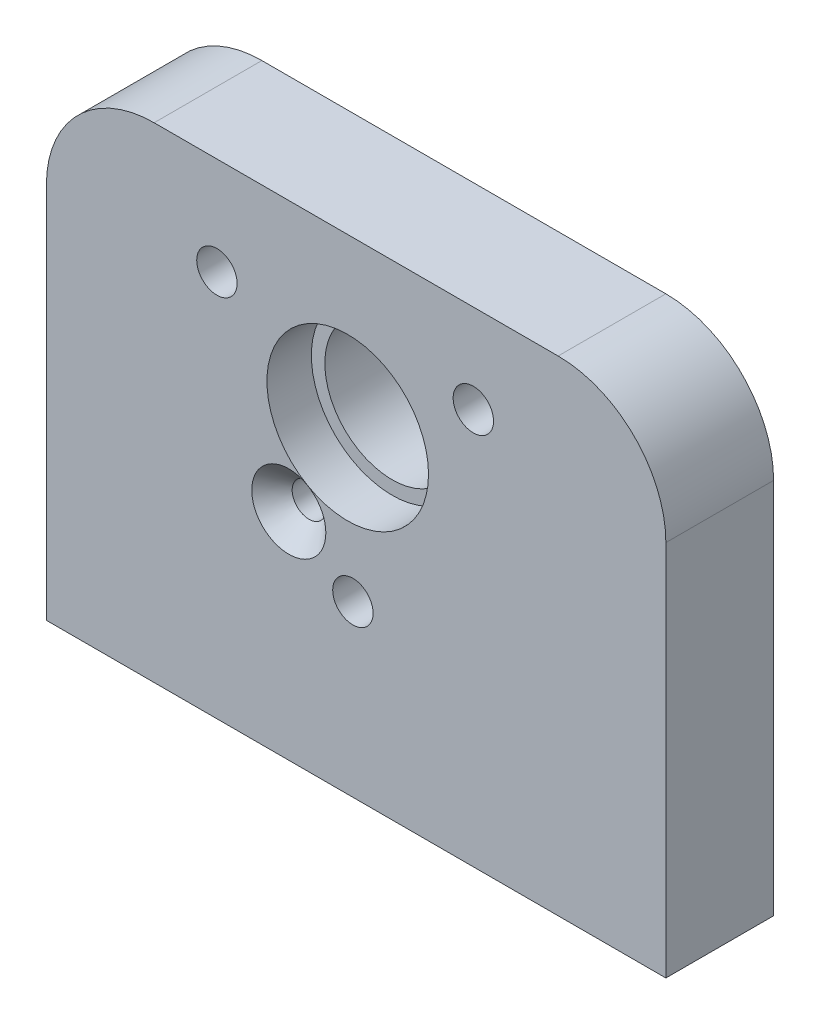
from build123d import *

# Parameters (mm, degrees)
SKETCH1_W                                         = 46
SKETCH1_H                                         = 36
BOSS_EXTRUDE1_DEPTH                               = 8
F_3_0MM_DOWEL_HOLE1_D                             = 3
F_3_0MM_DOWEL_HOLE1_DEPTH                         = 8.5
F_3_0MM_DOWEL_HOLE1_TIP                           = 0.901290929
F_4_0MM_DOWEL_HOLE1_D                             = 4
F_4_0MM_DOWEL_HOLE1_DEPTH                         = 7.5
F_4_0MM_DOWEL_HOLE1_TIP                           = 1.201721238
FILLET2_R                                         = 8
SKETCH16_W                                        = 5
SKETCH16_H                                        = 5
CUT_EXTRUDE1_DEPTH                                = 4.5
CSK_FOR_M2_5_FLAT_HEAD_MACHINE_SCREW1_D           = 2.5
CSK_FOR_M2_5_FLAT_HEAD_MACHINE_SCREW1_DEPTH       = 9.5
CSK_FOR_M2_5_FLAT_HEAD_MACHINE_SCREW1_CSINK_D     = 5.5
CSK_FOR_M2_5_FLAT_HEAD_MACHINE_SCREW1_CSINK_ANGLE = 90
CSK_FOR_M2_5_FLAT_HEAD_MACHINE_SCREW1_TIP         = 0.751075774
HOLE1_D                                           = 10
HOLE1_CBORE_D                                     = 12
HOLE1_CBORE_DEPTH                                 = 3.3
F_3_0_3_DIAMETER_HOLE1_D                          = 3
FILLET3_R                                         = 1
CUT_EXTRUDE2_DEPTH                                = 4


with BuildPart() as part:
    # Sketch1 → Boss-Extrude1 (new body)
    with BuildSketch(Plane.XY.offset(4.5)):
        Rectangle(SKETCH1_W, SKETCH1_H)
    extrude(amount=-BOSS_EXTRUDE1_DEPTH)

    # Ø3.0mm Dowel Hole1
    with Locations(Plane(origin=(0, -18, 0), x_dir=(-1, 0, 0), z_dir=(0, -1, 0))):
        with Locations((0, -0.5)):
            Hole(F_3_0MM_DOWEL_HOLE1_D / 2, depth=F_3_0MM_DOWEL_HOLE1_DEPTH)
            with Locations((0, 0, -(F_3_0MM_DOWEL_HOLE1_DEPTH + F_3_0MM_DOWEL_HOLE1_TIP / 2))):  # 118° drill point
                Cone(0, F_3_0MM_DOWEL_HOLE1_D / 2, F_3_0MM_DOWEL_HOLE1_TIP, mode=Mode.SUBTRACT)

    # Ø4.0mm Dowel Hole1
    with Locations(Plane(origin=(0, -18, 0), x_dir=(-1, 0, 0), z_dir=(0, -1, 0))):
        with Locations((19, -0.5), (-19, -0.5)):
            Hole(F_4_0MM_DOWEL_HOLE1_D / 2, depth=F_4_0MM_DOWEL_HOLE1_DEPTH)
            with Locations((0, 0, -(F_4_0MM_DOWEL_HOLE1_DEPTH + F_4_0MM_DOWEL_HOLE1_TIP / 2))):  # 118° drill point
                Cone(0, F_4_0MM_DOWEL_HOLE1_D / 2, F_4_0MM_DOWEL_HOLE1_TIP, mode=Mode.SUBTRACT)

    # Fillet2
    fillet2_edges = [part.edges().sort_by_distance(p)[0] for p in [
        (-23, 18, 0.5),
        (23, 18, 0.5),
    ]]
    fillet(fillet2_edges, radius=FILLET2_R)

    # Sketch16 → Cut-Extrude1 (cut)
    with BuildSketch(Plane(origin=(0, 0, -3.5), x_dir=(-1, 0, 0), z_dir=(0, 0, -1))):
        with Locations((5, -2)):
            Rectangle(SKETCH16_W, SKETCH16_H)
    extrude(amount=-CUT_EXTRUDE1_DEPTH, mode=Mode.SUBTRACT)

    # CSK for M2.5 Flat Head Machine Screw1
    with Locations(Plane(origin=(-5, -2, 4.5), x_dir=(1, 0, 0), z_dir=(0, 0, 1))):
        with Locations((0, 0)):
            CounterSinkHole(CSK_FOR_M2_5_FLAT_HEAD_MACHINE_SCREW1_D / 2, CSK_FOR_M2_5_FLAT_HEAD_MACHINE_SCREW1_CSINK_D / 2, depth=CSK_FOR_M2_5_FLAT_HEAD_MACHINE_SCREW1_DEPTH, counter_sink_angle=CSK_FOR_M2_5_FLAT_HEAD_MACHINE_SCREW1_CSINK_ANGLE)
            with Locations((0, 0, -(CSK_FOR_M2_5_FLAT_HEAD_MACHINE_SCREW1_DEPTH + CSK_FOR_M2_5_FLAT_HEAD_MACHINE_SCREW1_TIP / 2))):  # 118° drill point
                Cone(0, CSK_FOR_M2_5_FLAT_HEAD_MACHINE_SCREW1_D / 2, CSK_FOR_M2_5_FLAT_HEAD_MACHINE_SCREW1_TIP, mode=Mode.SUBTRACT)

    # Hole1 (through all)
    with Locations(Plane.XY.offset(4.5)):
        with Locations((-0.625, 5.577722283)):
            CounterBoreHole(HOLE1_D / 2, HOLE1_CBORE_D / 2, HOLE1_CBORE_DEPTH)

    # Ø3.0 (3) Diameter Hole1 (through all)
    with Locations(Plane(origin=(0, 0, -3.5), x_dir=(-1, 0, 0), z_dir=(0, 0, -1))):
        with Locations((-8.703529058, 11.40683419), (10.337423522, 10.741909474), (0.241105536, -5.415576814)):
            Hole(F_3_0_3_DIAMETER_HOLE1_D / 2)

    # Fillet3
    fillet3_edges = [part.edges().sort_by_distance(p)[0] for p in [
        (-7.5, 0.5, -1.25),
        (-7.5, -4.5, -1.25),
        (-2.5, -4.5, -1.25),
        (-2.5, 0.5, -1.25),
    ]]
    fillet(fillet3_edges, radius=FILLET3_R)

    # Sketch20 → Cut-Extrude2 (cut)
    with BuildSketch(Plane(origin=(0, 0, -3.5), x_dir=(-1, 0, 0), z_dir=(0, 0, -1))):
        Polygon((14.378875406, 10.741909474), (12.358149464, 14.241909474), (8.316697579, 14.241909474), (6.295971637, 10.741909474), (8.316697579, 7.241909474), (12.358149464, 7.241909474), align=None)
    extrude(amount=-CUT_EXTRUDE2_DEPTH, mode=Mode.SUBTRACT)


solid = part.part
